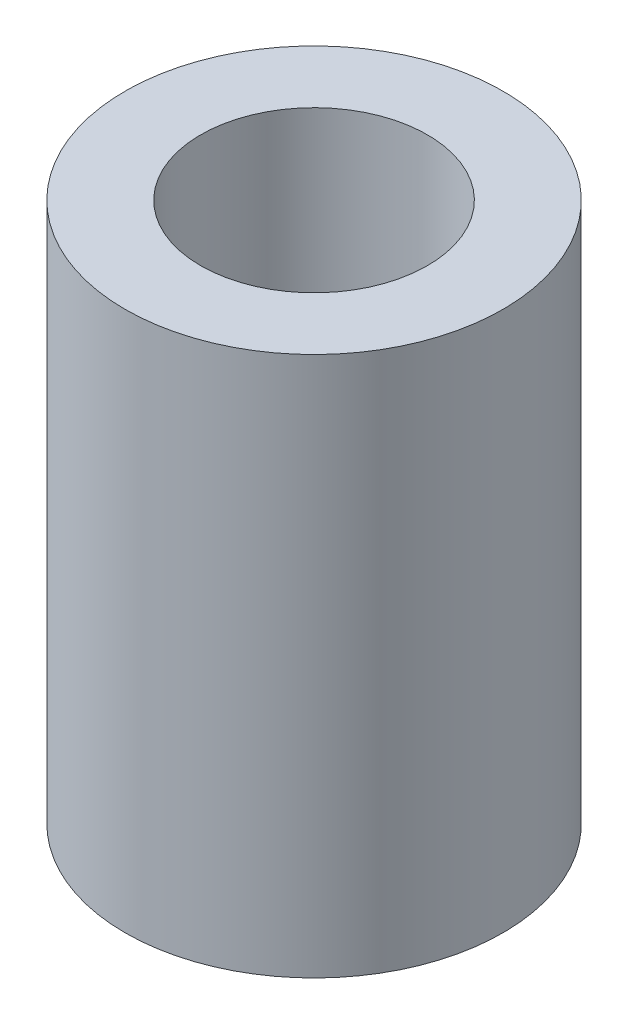
from build123d import *

# Parameters (mm, degrees)
SKETCH_1_R      = 3.5
SKETCH_1_R_2    = 2.1
EXTRUDE_1_DEPTH = 10


with BuildPart() as part:
    # 草图1 → 凸台-拉伸1 (new body)
    with BuildSketch(Plane(origin=(0, 0, 0), x_dir=(1, 0, 0), z_dir=(0, 1, 0))):
        with Locations(Location((0, 0, 0), (0, 0, 270))):
            Circle(SKETCH_1_R)
        with Locations(Location((0, 0, 0), (0, 0, 270))):
            Circle(SKETCH_1_R_2, mode=Mode.SUBTRACT)
    extrude(amount=EXTRUDE_1_DEPTH)


solid = part.part
